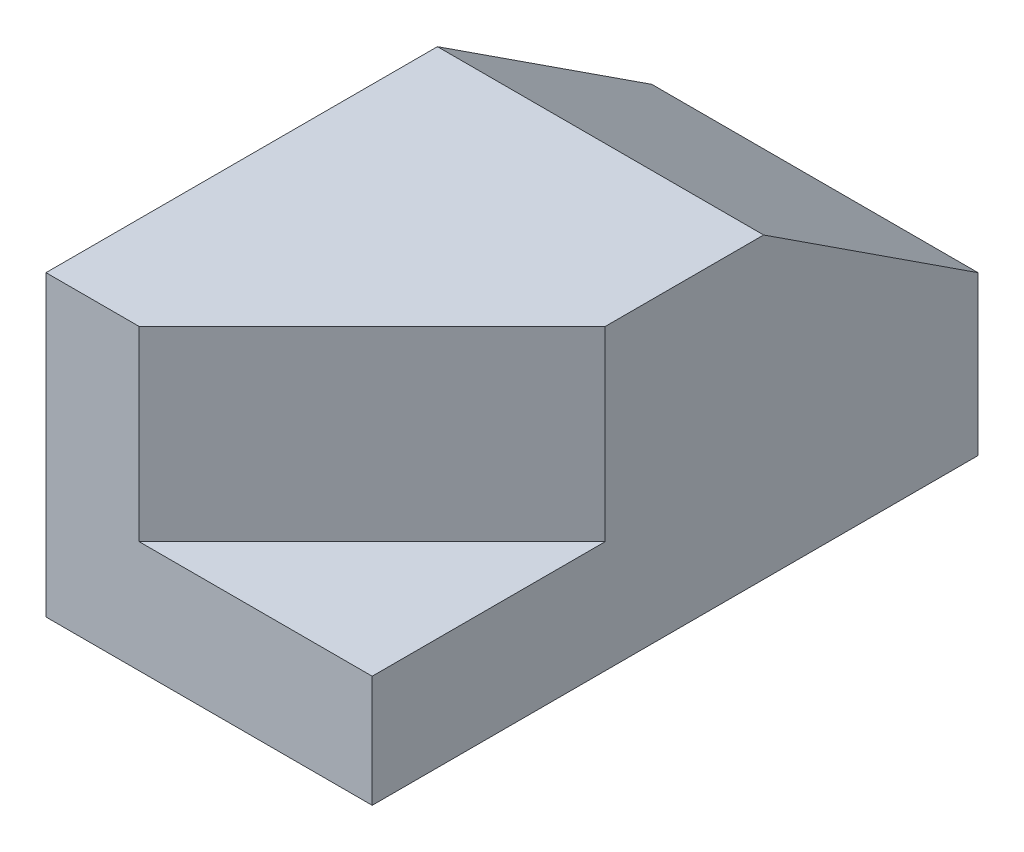
from build123d import *

# Parameters (mm, degrees)
BOSS_EXTRUDE1_DEPTH     = 35
CUT_EXTRUDE1_DEPTH      = 58.49130369
CUT_EXTRUDE1_DEPTH_BACK = 20


with BuildPart() as part:
    # Sketch1 → Boss-Extrude1 (new body)
    with BuildSketch(Plane(origin=(0, 0, 0), x_dir=(0, 0, -1), z_dir=(1, 0, 0))):
        Polygon((32.5, 1), (9.5, 16), (-32.5, 16), (-32.5, -16), (32.5, -16), align=None)
    extrude(amount=BOSS_EXTRUDE1_DEPTH)

    # Sketch2 → Cut-Extrude1 (cut, two sides: drawn at the far end of the back side and taken through both)
    with BuildSketch(Plane(origin=(0, 16, 0), x_dir=(1, 0, 0), z_dir=(0, 1, 0)).offset(-CUT_EXTRUDE1_DEPTH_BACK)):
        Polygon((140.55964583, 98.05964583), (35, -7.5), (10, -32.5), (-95.55964583, -138.05964583), (115.55964583, -349.178937489), (351.678937489, -113.05964583), align=None)
    extrude(amount=CUT_EXTRUDE1_DEPTH + CUT_EXTRUDE1_DEPTH_BACK, mode=Mode.SUBTRACT)


solid = part.part
